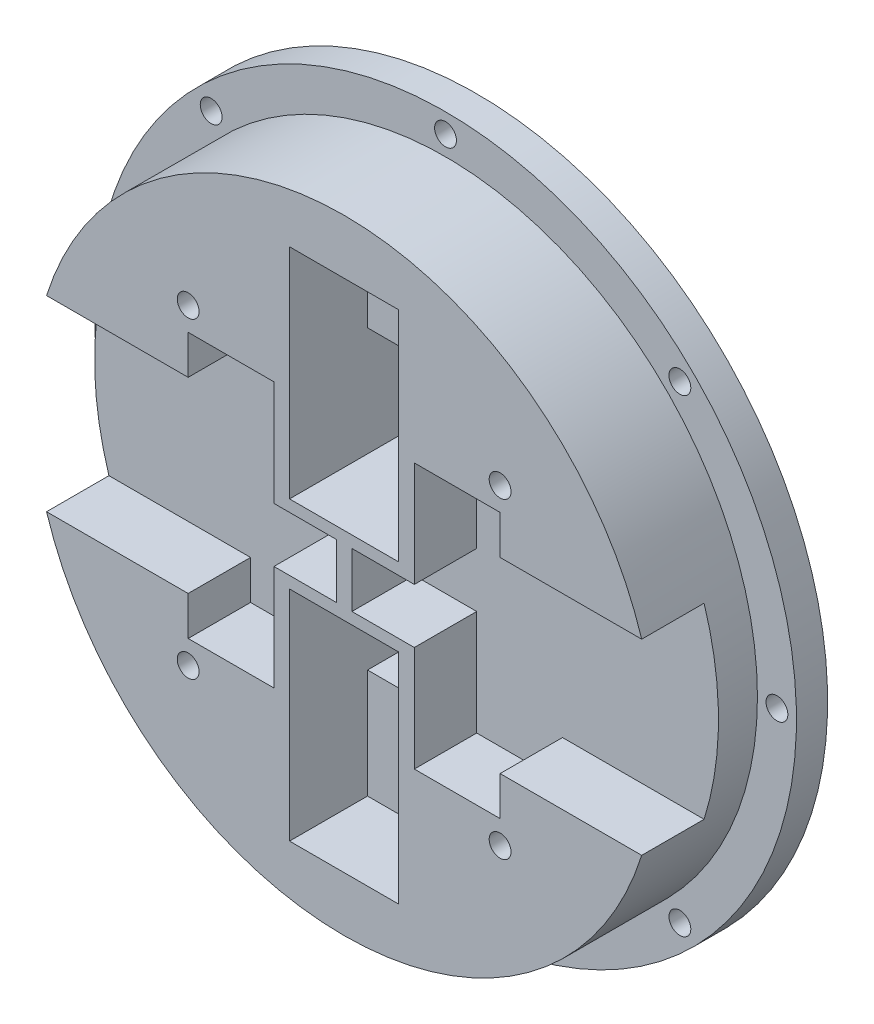
from build123d import *

# Parameters (mm, degrees)
SKETCH1_R           = 40
BOSS_EXTRUDE1_DEPTH = 13
CUT_EXTRUDE1_DEPTH  = 8
SKETCH2_4_R         = 1.4
CUT_EXTRUDE2_DEPTH  = 5
SKETCH3_W           = 14
SKETCH3_H           = 28
CUT_EXTRUDE6_DEPTH  = 10
SKETCH5_R           = 45
BOSS_EXTRUDE2_DEPTH = 4
SKETCH6_R           = 1.4
CUT_EXTRUDE8_DEPTH  = 4
SKETCH6_3_R         = 1.4
CUT_EXTRUDE9_DEPTH  = 4
SKETCH7_W           = 14
SKETCH7_H           = 14
CUT_EXTRUDE10_DEPTH = 17


with BuildPart() as part:
    # Sketch1 → Boss-Extrude1 (new body)
    with BuildSketch(Plane.XY):
        Circle(SKETCH1_R)
    extrude(amount=BOSS_EXTRUDE1_DEPTH)

    # Sketch2 → Cut-Extrude1 (cut)
    with BuildSketch(Plane.XY.offset(13)):
        Polygon((-40, 12), (-40, -12), (-20, -12), (-20, -17), (-9, -17), (-9, -3.5), (-1, -3.5), (-1, 3.5), (-9, 3.5), (-9, 17), (-20, 17), (-20, 12), align=None)
        Polygon((1, 3.5), (1, -3.5), (9, -3.5), (9, -17), (20, -17), (20, -12), (40, -12), (40, 12), (20, 12), (20, 17), (9, 17), (9, 3.5), align=None)
    extrude(amount=-CUT_EXTRUDE1_DEPTH, mode=Mode.SUBTRACT)

    # Sketch2<4> → Cut-Extrude2 (cut)
    with BuildSketch(Plane.XY.offset(13)):
        with Locations((-20, 20)):
            Circle(SKETCH2_4_R)
        with Locations((20, 20)):
            Circle(SKETCH2_4_R)
        with Locations((-20, -20)):
            Circle(SKETCH2_4_R)
        with Locations((20, -20)):
            Circle(SKETCH2_4_R)
    extrude(amount=-CUT_EXTRUDE2_DEPTH, mode=Mode.SUBTRACT)

    # Sketch3 → Cut-Extrude6 (cut)
    with BuildSketch(Plane.XY.offset(13)):
        with Locations((0, 19)):
            Rectangle(SKETCH3_W, SKETCH3_H)
        with Locations((0, -19)):
            Rectangle(SKETCH3_W, SKETCH3_H)
    extrude(amount=-CUT_EXTRUDE6_DEPTH, mode=Mode.SUBTRACT)

    # Sketch5 → Boss-Extrude2 (add)
    with BuildSketch(Plane(origin=(0, 0, 0), x_dir=(-1, 0, 0), z_dir=(0, 0, -1))):
        Circle(SKETCH5_R)
    extrude(amount=BOSS_EXTRUDE2_DEPTH)

    # Sketch6 → Cut-Extrude8 (cut)
    with BuildSketch(Plane(origin=(0, 0, 0), x_dir=(-1, 0, 0), z_dir=(0, 0, -1))):
        with Locations((0, 42.5)):
            Circle(SKETCH6_R)
        with Locations((30.0520382, 30.0520382)):
            Circle(SKETCH6_R)
        with Locations((42.5, 0)):
            Circle(SKETCH6_R)
        with Locations((30.0520382, -30.0520382)):
            Circle(SKETCH6_R)
        with Locations((0, -42.5)):
            Circle(SKETCH6_R)
        with Locations((-30.0520382, -30.0520382)):
            Circle(SKETCH6_R)
        with Locations((-42.5, 0)):
            Circle(SKETCH6_R)
        with Locations((-30.0520382, 30.0520382)):
            Circle(SKETCH6_R)
    extrude(amount=CUT_EXTRUDE8_DEPTH, mode=Mode.SUBTRACT)

    # Sketch6<3> → Cut-Extrude9 (cut)
    with BuildSketch(Plane(origin=(0, 0, 0), x_dir=(-1, 0, 0), z_dir=(0, 0, -1))):
        with Locations((0, 32.5)):
            Circle(SKETCH6_3_R)
        with Locations((22.980970389, 22.980970389)):
            Circle(SKETCH6_3_R)
        with Locations((32.5, 0)):
            Circle(SKETCH6_3_R)
        with Locations((22.980970389, -22.980970389)):
            Circle(SKETCH6_3_R)
        with Locations((0, -32.5)):
            Circle(SKETCH6_3_R)
        with Locations((-22.980970389, -22.980970389)):
            Circle(SKETCH6_3_R)
        with Locations((-32.5, 0)):
            Circle(SKETCH6_3_R)
        with Locations((-22.980970389, 22.980970389)):
            Circle(SKETCH6_3_R)
    extrude(amount=CUT_EXTRUDE9_DEPTH, mode=Mode.SUBTRACT)

    # Sketch7 → Cut-Extrude10 (cut)
    with BuildSketch(Plane.XY.offset(13)):
        with Locations((0, 12)):
            Rectangle(SKETCH7_W, SKETCH7_H)
        with Locations((0, -12)):
            Rectangle(SKETCH7_W, SKETCH7_H)
    extrude(amount=-CUT_EXTRUDE10_DEPTH, mode=Mode.SUBTRACT)


solid = part.part
